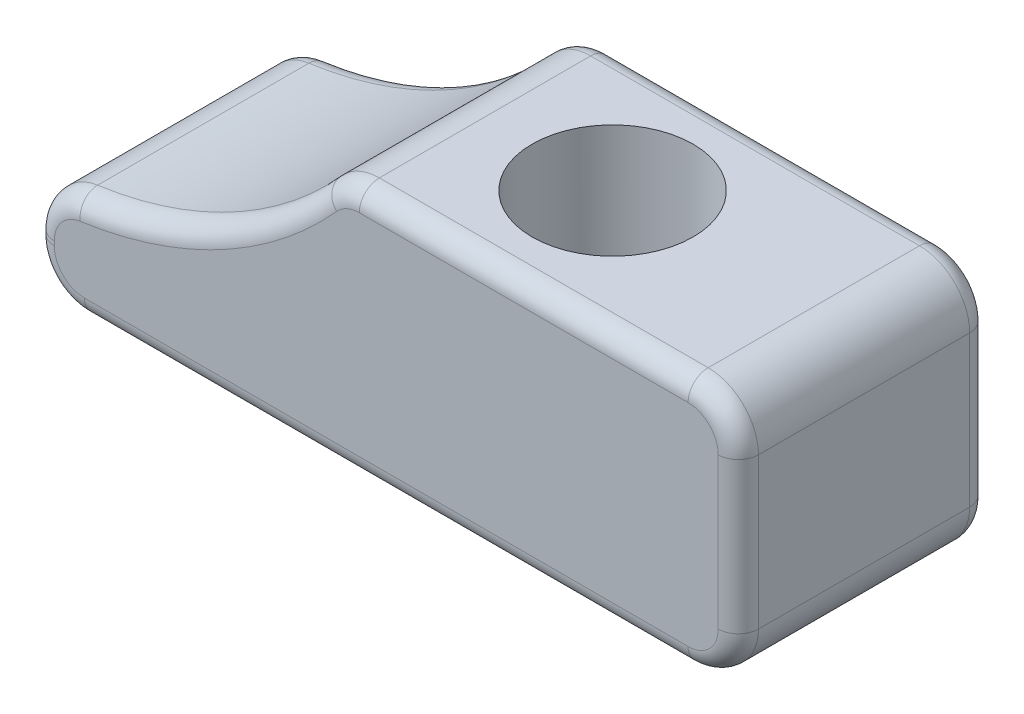
from build123d import *

# Parameters (mm, degrees)
ESQUISSE1_W                  = 70
ESQUISSE1_H                  = 25
BOSS_EXTRU_1_DEPTH           = 25
ENL_V_MAT_EXTRU_1_DEPTH      = 79.421935707
ENL_V_MAT_EXTRU_1_DEPTH_BACK = 79.421935707
CONG_1_R                     = 5
CONG_2_R                     = 2
ENL_V_MAT_EXTRU_2_DEPTH      = 79.421935739
ENL_V_MAT_EXTRU_2_DEPTH_BACK = 79.421935739
ESQUISSE3_R                  = 8


with BuildPart() as part:
    # Esquisse1 → Boss.-Extru.1 (new body)
    with BuildSketch(Plane.XY):
        with Locations((35, 12.5)):
            Rectangle(ESQUISSE1_W, ESQUISSE1_H)
    extrude(amount=BOSS_EXTRU_1_DEPTH)

    # Esquisse2 → Enlèv. mat.-Extru.1 (cut, two sides: drawn at the far end of the back side and taken through both)
    with BuildSketch(Plane.XY.offset(25).offset(-ENL_V_MAT_EXTRU_1_DEPTH_BACK)):
        with BuildLine():
            Line((30, 25), (0, 25))
            Line((0, 25), (0, 10))
            ThreePointArc((0, 10), (16.648162051, 14.203675898), (30, 25))
        make_face()
    extrude(amount=ENL_V_MAT_EXTRU_1_DEPTH + ENL_V_MAT_EXTRU_1_DEPTH_BACK, mode=Mode.SUBTRACT)

    # Congé1
    cong_1_edges = [part.edges().sort_by_distance(p)[0] for p in [
        (30, 25, 12.5),
        (0, 10, 12.5),
        (70, 25, 12.5),
        (70, 0, 12.5),
        (0, 0, 12.5),
    ]]
    fillet(cong_1_edges, radius=CONG_1_R)

    # Congé2
    cong_2_edges = [part.edges().sort_by_distance(p)[0] for p in [
        (35, 0, 0),
        (35, 0, 25),
        (17.598161914, 14.694657605, 0),
        (48.658916792, 25, 0),
        (70, 12.5, 0),
        (0, 5.207778491, 0),
        (68.535533906, 23.535533906, 0),
        (68.535533906, 1.464466094, 0),
        (1.227276928, 8.696800743, 0),
        (30.275283676, 24.563769261, 0),
        (1.464466094, 1.464466094, 0),
        (0, 5.207778491, 25),
        (48.658916792, 25, 25),
        (17.598161914, 14.694657605, 25),
        (70, 12.5, 25),
        (68.535533906, 23.535533906, 25),
        (68.535533906, 1.464466094, 25),
        (1.227276928, 8.696800743, 25),
        (30.275283676, 24.563769261, 25),
        (1.464466094, 1.464466094, 25),
    ]]
    fillet(cong_2_edges, radius=CONG_2_R)

    # Esquisse3 → Enlèv. mat.-Extru.2 (cut, two sides: drawn at the far end of the back side and taken through both)
    with BuildSketch(Plane(origin=(0, 25, 0), x_dir=(1, 0, 0), z_dir=(0, 1, 0)).offset(-ENL_V_MAT_EXTRU_2_DEPTH_BACK)):
        with Locations(Location((45, -12.5, 0), (0, 0, 270))):
            Circle(ESQUISSE3_R)
    extrude(amount=ENL_V_MAT_EXTRU_2_DEPTH + ENL_V_MAT_EXTRU_2_DEPTH_BACK, mode=Mode.SUBTRACT)


solid = part.part
